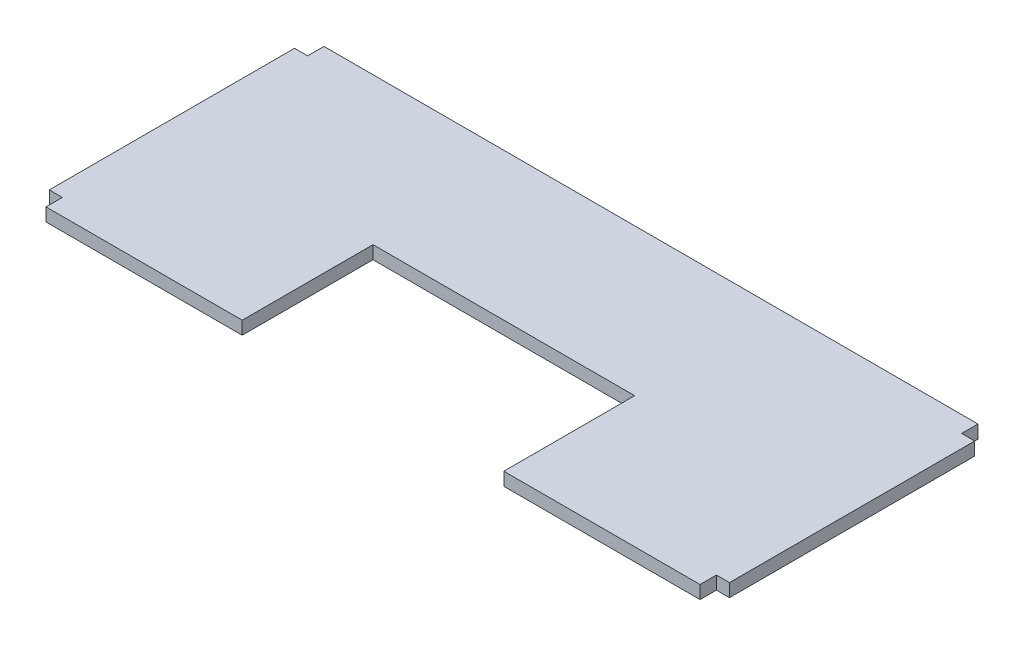
from build123d import *

# Parameters (mm, degrees)
SKETCH_1_W          = 2
SKETCH_1_H          = 37.5
SKETCH_1_W_2        = 100
SKETCH_1_H_2        = 42.5
EXTRUDE_1_DEPTH     = 2
CUT_EXTRUDE_1_REACH = 112.518
SKETCH_2_W          = 40
SKETCH_2_H          = 20


with BuildPart() as part:
    # 草图1 → 凸台-拉伸1 (new body)
    with BuildSketch(Plane(origin=(0, 0, 0), x_dir=(1, 0, 0), z_dir=(0, 1, 0))):
        with Locations((-1, 21.25)):
            Rectangle(SKETCH_1_W, SKETCH_1_H)
        with Locations((50, 21.25)):
            Rectangle(SKETCH_1_W_2, SKETCH_1_H_2)
        with Locations((101, 21.25)):
            Rectangle(SKETCH_1_W, SKETCH_1_H)
    extrude(amount=EXTRUDE_1_DEPTH)

    # 草图2 → 切除-拉伸1 (cut, up to next)
    with BuildSketch(Plane(origin=(0, 2, 0), x_dir=(1, 0, 0), z_dir=(0, 1, 0)), mode=Mode.PRIVATE) as cut_extrude_1_sk1:
        with Locations((50, 10)):
            Rectangle(SKETCH_2_W, SKETCH_2_H)
    cut_extrude_1_tool1 = extrude(cut_extrude_1_sk1.sketch, amount=-CUT_EXTRUDE_1_REACH, mode=Mode.PRIVATE) & part.part
    add(cut_extrude_1_tool1.solids().sort_by_distance((50, 2, -10))[0], mode=Mode.SUBTRACT)


solid = part.part
